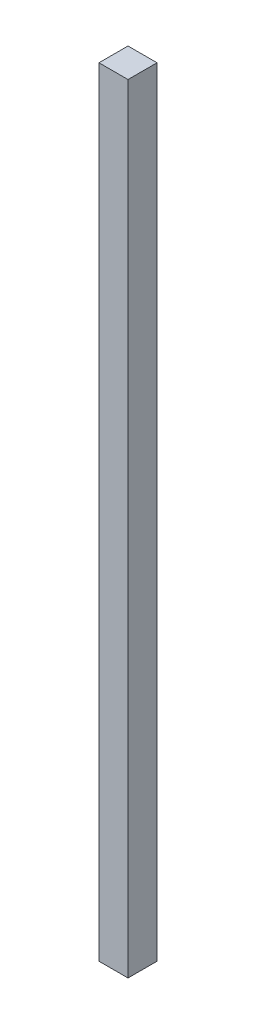
from build123d import *

# Parameters (mm, degrees)
SKETCH1_W           = 20
SKETCH1_H           = 20
BOSS_EXTRUDE1_DEPTH = 536


with BuildPart() as part:
    # Sketch1 → Boss-Extrude1 (new body)
    with BuildSketch(Plane(origin=(0, 0, 0), x_dir=(1, 0, 0), z_dir=(0, 1, 0))):
        with Locations((10, 10)):
            Rectangle(SKETCH1_W, SKETCH1_H)
    extrude(amount=BOSS_EXTRUDE1_DEPTH)


solid = part.part
